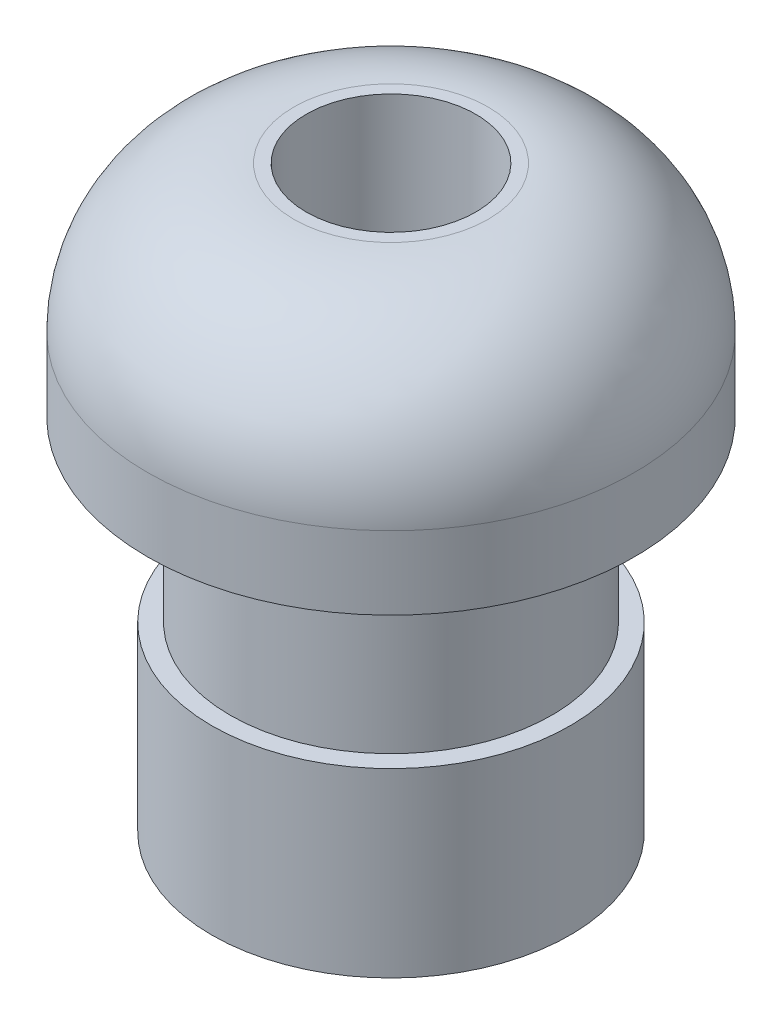
from build123d import *

# Parameters (mm, degrees)
SKETCH1_R               = 3.1115
BOSS_EXTRUDE1_DEPTH     = 3.1496
SKETCH3_R               = 2.794
BOSS_EXTRUDE2_DEPTH     = 3.0988
SKETCH4_R               = 4.2291
BOSS_EXTRUDE3_DEPTH     = 3.81
CUT_EXTRUDE1_DEPTH      = 12.702221335
CUT_EXTRUDE1_DEPTH_BACK = 12.702221335
SKETCH5_R               = 1.4732
FILLET1_R               = 2.54


with BuildPart() as part:
    # Sketch1 → Boss-Extrude1 (new body)
    with BuildSketch(Plane(origin=(0, 0, 0), x_dir=(1, 0, 0), z_dir=(0, 1, 0))):
        with Locations(Location((0, 0, 0), (0, 0, 270))):
            Circle(SKETCH1_R)
    extrude(amount=BOSS_EXTRUDE1_DEPTH)

    # Sketch3 → Boss-Extrude2 (add)
    with BuildSketch(Plane(origin=(0, 3.1496, 0), x_dir=(1, 0, 0), z_dir=(0, 1, 0))):
        with Locations(Location((0, 0, 0), (0, 0, 270))):
            Circle(SKETCH3_R)
    extrude(amount=BOSS_EXTRUDE2_DEPTH)

    # Sketch4 → Boss-Extrude3 (add)
    with BuildSketch(Plane(origin=(0, 6.2484, 0), x_dir=(1, 0, 0), z_dir=(0, 1, 0))):
        with Locations(Location((0, 0, 0), (0, 0, 90))):
            Circle(SKETCH4_R)
    extrude(amount=BOSS_EXTRUDE3_DEPTH)

    # Sketch5 → Cut-Extrude1 (cut, two sides: drawn at the far end of the back side and taken through both)
    with BuildSketch(Plane(origin=(0, 10.0584, 0), x_dir=(1, 0, 0), z_dir=(0, 1, 0)).offset(-CUT_EXTRUDE1_DEPTH_BACK)):
        with Locations(Location((0, 0, 0), (0, 0, 270))):
            Circle(SKETCH5_R)
    extrude(amount=CUT_EXTRUDE1_DEPTH + CUT_EXTRUDE1_DEPTH_BACK, mode=Mode.SUBTRACT)

    # Fillet1
    fillet1_edges = [part.edges().sort_by_distance(p)[0] for p in [
        (0, 10.0584, 4.2291),
    ]]
    fillet(fillet1_edges, radius=FILLET1_R)


solid = part.part
